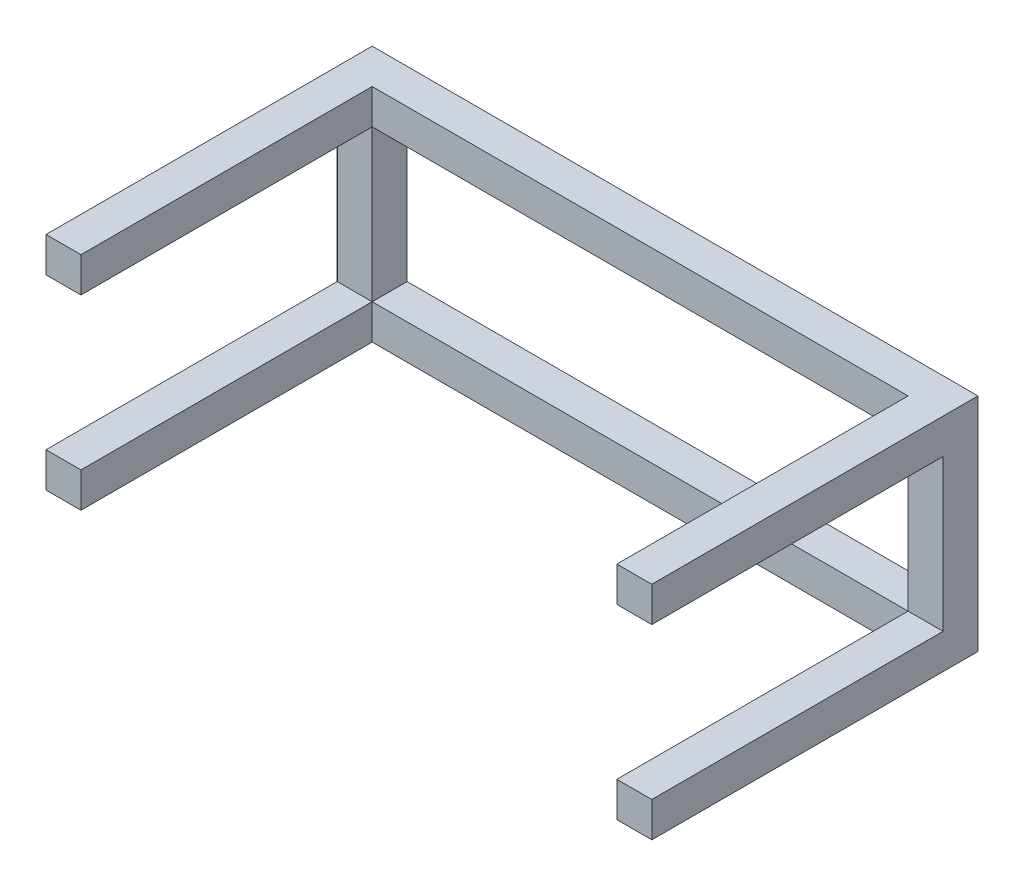
from build123d import *

# Parameters (mm, degrees)
SKETCH_1_W      = 30
SKETCH_1_H      = 190
SKETCH_1_W_2    = 460
SKETCH_1_H_2    = 30
EXTRUDE_1_DEPTH = 30
SKETCH_2_W      = 30
SKETCH_2_H      = 30
EXTRUDE_2_DEPTH = 250


with BuildPart() as part:
    # 草图1 → 凸台-拉伸1 (new body)
    with BuildSketch(Plane.XY):
        with Locations((15, 95)):
            Rectangle(SKETCH_1_W, SKETCH_1_H)
        with Locations((260, 175)):
            Rectangle(SKETCH_1_W_2, SKETCH_1_H_2)
        with Locations((260, 15)):
            Rectangle(SKETCH_1_W_2, SKETCH_1_H_2)
        Polygon((490, 30), (490, 0), (520, 0), (520, 190), (490, 190), (490, 160), align=None)
    extrude(amount=EXTRUDE_1_DEPTH)

    # 草图2 → 凸台-拉伸2 (add)
    with BuildSketch(Plane.XY.offset(30)):
        with Locations((15, 175)):
            Rectangle(SKETCH_2_W, SKETCH_2_H)
        with Locations((15, 15)):
            Rectangle(SKETCH_2_W, SKETCH_2_H)
        with Locations((505, 175)):
            Rectangle(SKETCH_2_W, SKETCH_2_H)
        with Locations((505, 15)):
            Rectangle(SKETCH_2_W, SKETCH_2_H)
    extrude(amount=EXTRUDE_2_DEPTH)


solid = part.part
